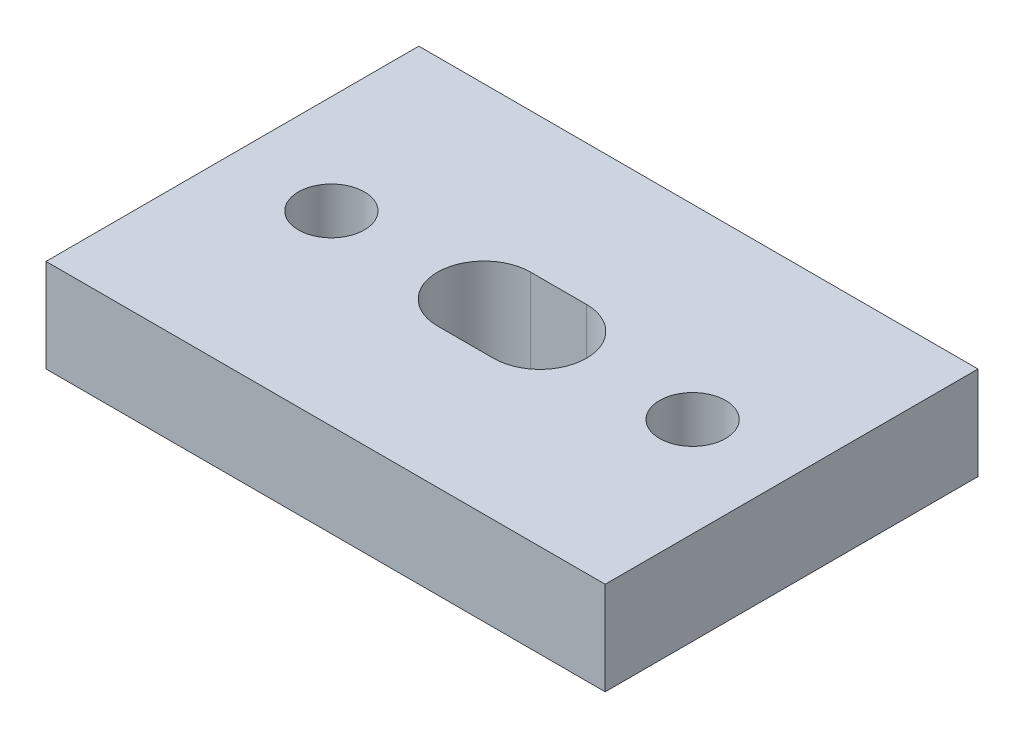
from build123d import *

# Parameters (mm, degrees)
SKETCH1_W           = 38.1
SKETCH1_H           = 25.4
SKETCH1_R           = 2.2479
BOSS_EXTRUDE1_DEPTH = 6.35


with BuildPart() as part:
    # Sketch1 → Boss-Extrude1 (new body)
    with BuildSketch(Plane(origin=(0, 0, 0), x_dir=(1, 0, 0), z_dir=(0, 1, 0))):
        Rectangle(SKETCH1_W, SKETCH1_H)
        with Locations(Location((-12.3063, 0, 0), (0, 0, 270))):
            Circle(SKETCH1_R, mode=Mode.SUBTRACT)
        with Locations(Location((12.3063, 0, 0), (0, 0, 270))):
            Circle(SKETCH1_R, mode=Mode.SUBTRACT)
        with BuildLine():
            Line((-1.905, 3.175), (1.905, 3.175))
            ThreePointArc((1.905, 3.175), (5.08, 0), (1.905, -3.175))
            Line((1.905, -3.175), (-1.905, -3.175))
            ThreePointArc((-1.905, -3.175), (-5.08, 0), (-1.905, 3.175))
        make_face(mode=Mode.SUBTRACT)
    extrude(amount=BOSS_EXTRUDE1_DEPTH)


solid = part.part
